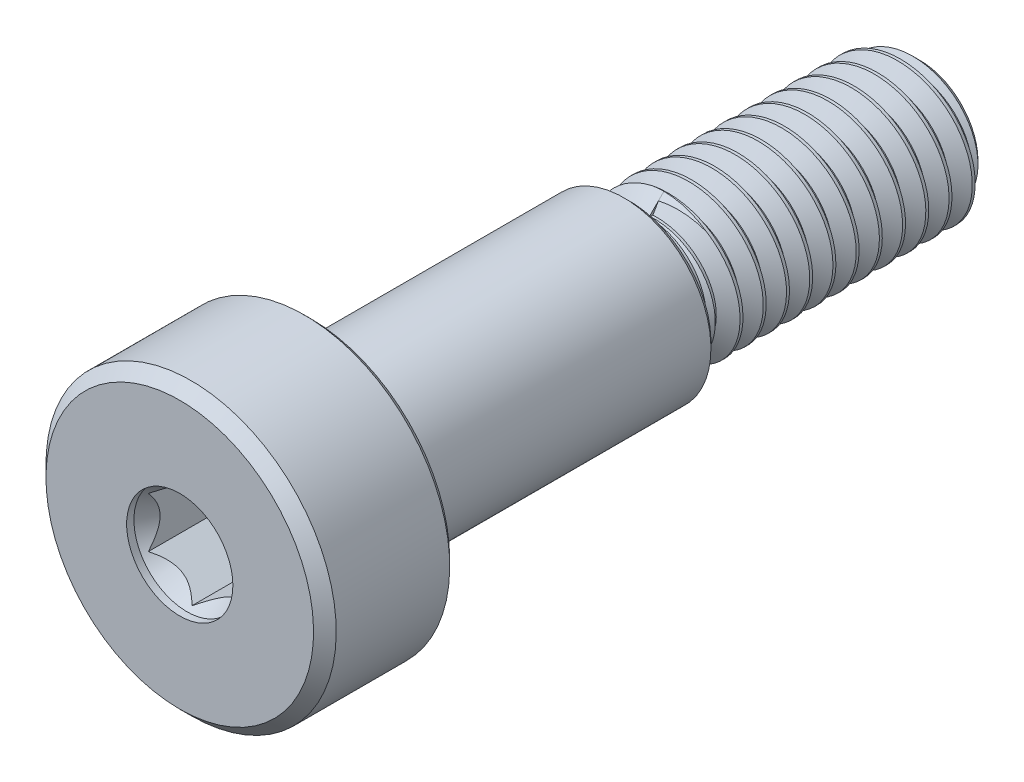
from build123d import *

# Parameters (mm, degrees)
CUT_EXTRUDE1_DEPTH     = 2.5
SKETCH4_R              = 1.83
CUT_EXTRUDE2_DEPTH     = 0.25
CUT_EXTRUDE3_START     = -0.25
SKETCH4_2_R            = 1.83
CUT_EXTRUDE3_DEPTH     = 1.875
CUT_EXTRUDE3_DRAFT     = -30
CUT_SWEEP1_PITCH       = 0.8
CUT_SWEEP1_HEIGHT      = 9.6
CUT_SWEEP1_RADIUS      = 2.5
CUT_SWEEP1_START_ANGLE = 90


with BuildPart() as part:
    # Sketch2 → Revolve1 (revolve)
    with BuildSketch(Plane(origin=(0, 0, 0), x_dir=(0, 0, -1), z_dir=(1, 0, 0)), mode=Mode.PRIVATE) as revolve1_sk:
        with BuildLine():
            Line((12.75, 0), (12.75, 2))
            Line((12.75, 2), (12.25, 2.5))
            Line((12.25, 2.5), (3.929422863, 2.5))
            Line((3.929422863, 2.5), (3.409807621, 1.980384758))
            Line((3.409807621, 1.980384758), (3.009807621, 1.980384758))
            ThreePointArc((3.009807621, 1.980384758), (2.82609589, 2.056480648), (2.75, 2.240192379))
            Line((2.75, 2.240192379), (2.75, 2.8))
            Line((2.75, 2.8), (2.55, 3))
            Line((2.55, 3), (-7.186847276, 3))
            Line((-7.186847276, 3), (-7.5388, 2.7968))
            Line((-7.5388, 2.7968), (-7.6277, 2.7968))
            ThreePointArc((-7.6277, 2.7968), (-8.06773255, 2.97906745), (-8.25, 3.4191))
            Line((-8.25, 3.4191), (-8.25, 4.8))
            Line((-8.25, 4.8), (-8.45, 5))
            Line((-8.45, 5), (-12.3595, 5))
            Line((-12.3595, 5), (-12.75, 4.6095))
            Line((-12.75, 4.6095), (-12.75, 0))
            Line((-12.75, 0), (12.75, 0))
        make_face()
    revolve(revolve1_sk.sketch.rotate(Axis((0, 0, 12.75), (0, 0, -1)), 180), axis=Axis((0, 0, 12.75), (0, 0, -1)))

    # Sketch3 → Cut-Extrude1 (cut)
    with BuildSketch(Plane.XY.offset(12.75)):
        Polygon((0, 1.732050808), (-1.5, 0.866025404), (-1.5, -0.866025404), (0, -1.732050808), (1.5, -0.866025404), (1.5, 0.866025404), align=None)
    extrude(amount=-CUT_EXTRUDE1_DEPTH, mode=Mode.SUBTRACT)

    # Sketch4 → Cut-Extrude2 (cut)
    with BuildSketch(Plane.XY.offset(12.75)):
        Circle(SKETCH4_R)
    extrude(amount=-CUT_EXTRUDE2_DEPTH, mode=Mode.SUBTRACT)


with BuildPart() as cut_extrude3_tool:
    # Sketch4<2> → Cut-Extrude3 (with draft: the straight prism first)
    with BuildSketch(Plane.XY.offset(12.75).offset(CUT_EXTRUDE3_START)):
        Circle(SKETCH4_2_R)
    extrude(amount=-CUT_EXTRUDE3_DEPTH)
    # Cut-Extrude3: the draft: its side faces are tilted about the plane it starts from
    cut_extrude3_sides = [cut_extrude3_tool.faces().sort_by_distance(p)[0] for p in [
        (-1.83, 0, 11.5625),
    ]]
    draft(cut_extrude3_sides, Plane.XY.offset(12.75).offset(CUT_EXTRUDE3_START), CUT_EXTRUDE3_DRAFT)


with BuildPart() as part_1:
    add(part.part)

    # Cut-Extrude3: cut by cut_extrude3_tool
    add(cut_extrude3_tool.part, mode=Mode.SUBTRACT)

    # Cut-Sweep1: sweep along a helix
    with BuildLine() as cut_sweep1_path:
        add(Helix(CUT_SWEEP1_PITCH, CUT_SWEEP1_HEIGHT, CUT_SWEEP1_RADIUS, center=(0, 0, -12.75), direction=(0, 0, 1), mode=Mode.PRIVATE).rotate(Axis((0, 0, -12.75), (0, 0, 1)), CUT_SWEEP1_START_ANGLE))
    # Sketch6 → Cut-Sweep1 (sweep, cut)
    with BuildSketch(Plane(origin=(0, 0, 0), x_dir=(0, 0, -1), z_dir=(1, 0, 0))):
        Polygon((12.725, 2.54330127), (13.475, 2.54330127), (13.15, 1.980384758), (13.05, 1.980384758), align=None)
    sweep(path=cut_sweep1_path.line, is_frenet=True, mode=Mode.SUBTRACT)


solid = part_1.part
